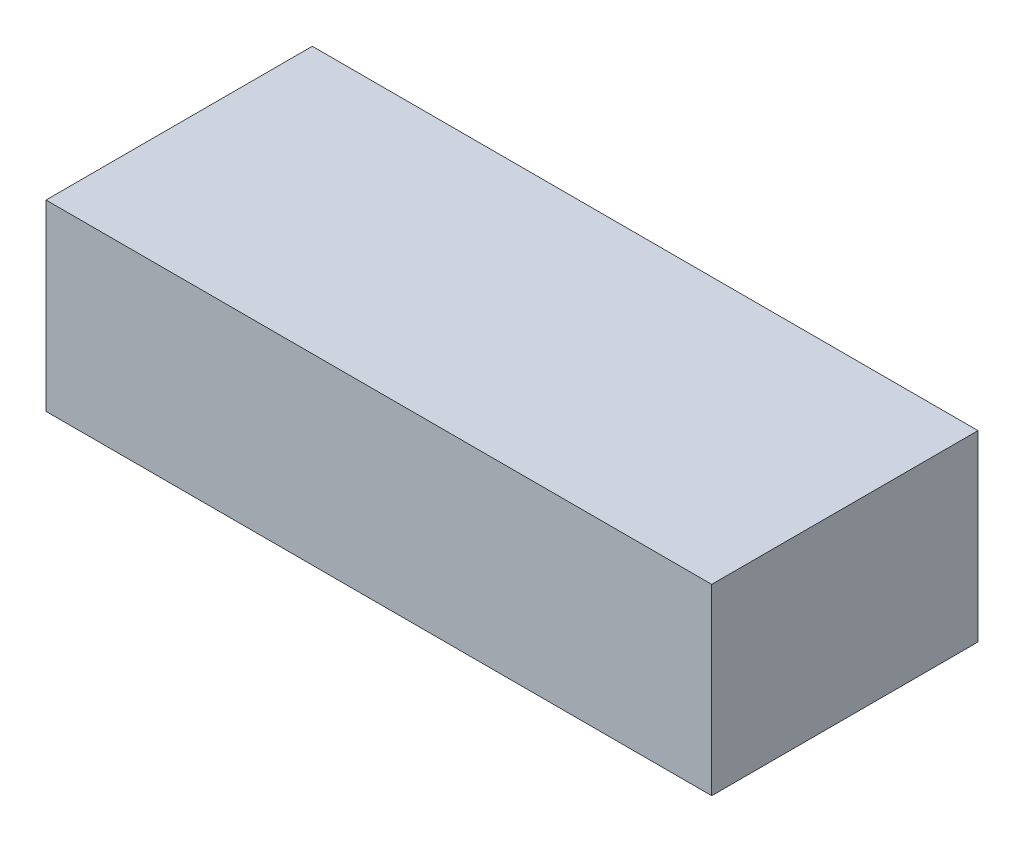
from build123d import *

# Parameters (mm, degrees)
SKETCH1_W      = 25.4
SKETCH1_H      = 6.985
EXTRUDE1_DEPTH = 10.16


with BuildPart() as part:
    # Sketch1 → Extrude1 (new body)
    with BuildSketch(Plane.XY):
        with Locations((12.7, -3.4925)):
            Rectangle(SKETCH1_W, SKETCH1_H)
    extrude(amount=EXTRUDE1_DEPTH)


solid = part.part
